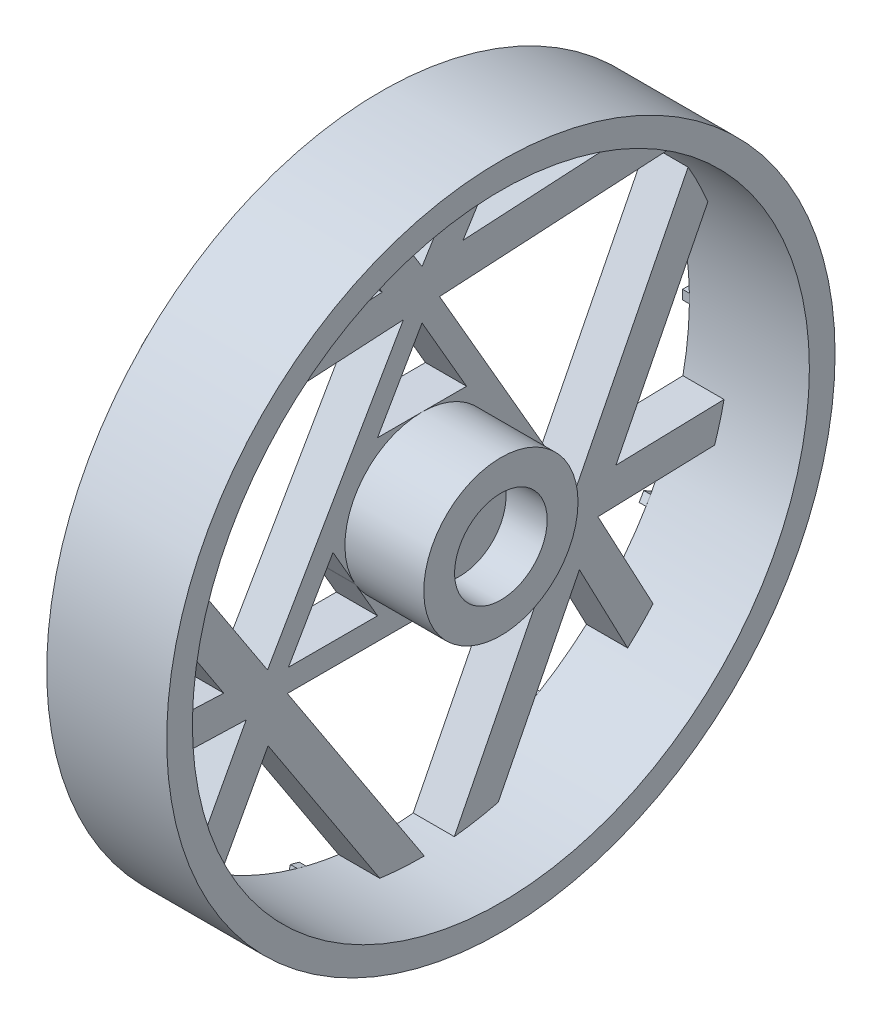
from build123d import *

# Parameters (mm, degrees)
SKETCH4_R             = 97.5
SKETCH4_R_2           = 90
BOSS_EXTRUDE1_DEPTH   = 35
SKETCH4_R_3           = 22.5
BOSS_EXTRUDE1_2_DEPTH = 35
BOSS_EXTRUDE2_DEPTH   = 12
BOSS_EXTRUDE3_DEPTH   = 12
BOSS_EXTRUDE8_DEPTH   = 12
CIRPATTERN1_COUNT     = 3
SKETCH21_R            = 13.5
CUT_EXTRUDE3_DEPTH    = 12
BOSS_EXTRUDE9_DEPTH   = 12
SKETCH24_R            = 13.983659749
SKETCH24_R_2          = 11.823757764
SKETCH24_R_3          = 1.244512658
CUT_EXTRUDE4_DEPTH    = 4
SKETCH25_W            = 2.692876203
SKETCH25_H            = 4.720029148
SKETCH25_W_2          = 4.720029148
SKETCH25_H_2          = 2.692876204
SKETCH25_W_3          = 2.692876204
SKETCH25_H_3          = 2.692876203
BOSS_EXTRUDE10_DEPTH  = 2


with BuildPart() as part:
    # Sketch4 → Boss-Extrude1 (new body)
    with BuildSketch(Plane(origin=(0, 0, 0), x_dir=(0, 0, -1), z_dir=(1, 0, 0))):
        Circle(SKETCH4_R)
        Circle(SKETCH4_R_2, mode=Mode.SUBTRACT)
    extrude(amount=BOSS_EXTRUDE1_DEPTH)



with BuildPart() as body_2:
    # Sketch4 → Boss-Extrude1 2 (new body)
    with BuildSketch(Plane(origin=(0, 0, 0), x_dir=(0, 0, -1), z_dir=(1, 0, 0))):
        Circle(SKETCH4_R_3)
    extrude(amount=BOSS_EXTRUDE1_2_DEPTH)

    # Sketch21 → Cut-Extrude3 (cut)
    with BuildSketch(Plane(origin=(35, 0, 0), x_dir=(0, 0, -1), z_dir=(1, 0, 0))):
        Circle(SKETCH21_R)
    extrude(amount=-CUT_EXTRUDE3_DEPTH, mode=Mode.SUBTRACT)


with BuildPart() as body_3:
    # Sketch1 → Boss-Extrude2 (new body)
    with BuildSketch(Plane(origin=(0, 0, 0), x_dir=(0, 0, -1), z_dir=(1, 0, 0))):
        Polygon((50.193376868, -28.979159646), (0, 57.958319293), (-50.193376868, -28.979159646), align=None)
        Polygon((38.97114317, -22.5), (0, 45), (-38.97114317, -22.5), align=None, mode=Mode.SUBTRACT)
    extrude(amount=BOSS_EXTRUDE2_DEPTH)


with BuildPart() as part_1:
    add(part.part)

    add(body_3.part)  # Boss-Extrude3 merges body 3
    # Sketch8 → Boss-Extrude3 (add)
    with BuildSketch(Plane(origin=(0, 0, 0), x_dir=(0, 0, -1), z_dir=(1, 0, 0))):
        with BuildLine():
            Line((5.455789025, -97.347236048), (-87.033073918, 43.94876613))
            ThreePointArc((-87.033073918, 43.94876613), (-89.670128884, 38.282084399), (-91.938690055, 32.458084833))
            Line((-91.938690055, 32.458084833), (-7.037829715, -97.2456629))
            ThreePointArc((-7.037829715, -97.2456629), (-0.792649016, -97.496777934), (5.455789025, -97.347236048))
        make_face()
        with BuildLine():
            ThreePointArc((87.736129337, 42.527892129), (84.831010986, 48.061934783), (81.577284893, 53.398469917))
            Line((81.577284893, 53.398469917), (5.455789025, -97.347236048))
            ThreePointArc((5.455789025, -97.347236048), (11.681806842, -96.797651774), (17.859819003, -95.850283595))
            Line((17.859819003, -95.850283595), (87.736129337, 42.527892129))
        make_face()
        with BuildLine():
            Line((-87.033073918, 43.94876613), (81.577284893, 53.398469917))
            ThreePointArc((81.577284893, 53.398469917), (77.988322042, 58.515567374), (74.078871051, 63.392198761))
            Line((74.078871051, 63.392198761), (-80.698299622, 54.717770771))
            ThreePointArc((-80.698299622, 54.717770771), (-84.03836197, 49.434843151), (-87.033073918, 43.94876613))
        make_face()
    extrude(amount=BOSS_EXTRUDE3_DEPTH)

    # Sketch10 → Boss-Extrude8 (add)
    with BuildSketch(Plane(origin=(0, 0, 0), x_dir=(0, 0, -1), z_dir=(1, 0, 0))):
        with BuildLine():
            ThreePointArc((17.95863159, 88.190064925), (23.214218937, 87.469047382), (28.135682808, 85.489083238))
            Line((28.135682808, 85.489083238), (5.107007883, 49.112722165))
            Line((5.107007883, 49.112722165), (0, 59.240476451))
            Line((0, 59.240476451), (17.95863159, 88.190064925))
        make_face()
        with BuildLine():
            Line((0, 59.240476451), (-17.95863159, 88.190064925))
            ThreePointArc((-17.95863159, 88.190064925), (-23.214218937, 87.469047382), (-28.135682808, 85.489083238))
            Line((-28.135682808, 85.489083238), (-5.448558323, 48.52113945))
            Line((-5.448558323, 48.52113945), (0, 59.240476451))
        make_face()
    boss_extrude8 = extrude(amount=BOSS_EXTRUDE8_DEPTH)

    # CirPattern1: Boss-Extrude8 ×3 about axis
    cirpattern1_axis = Axis((0, 0, 0), (1, 0, 0))
    for i in range(1, CIRPATTERN1_COUNT):
        add(boss_extrude8.rotate(cirpattern1_axis, i * 360 / CIRPATTERN1_COUNT))


    add(body_2.part)  # Boss-Extrude9 merges body 2
    # Sketch23 → Boss-Extrude9 (add)
    with BuildSketch(Plane.ZY):
        Polygon((-12.989618466, 22.501320846), (12.989618466, 22.501320846), (25.980762114, 0), (12.989618466, -22.5), (-12.989618466, -22.5), (-25.980380818, 0.000660423), align=None)
    extrude(amount=-BOSS_EXTRUDE9_DEPTH)

    # Sketch24 → Cut-Extrude4 (cut)
    # profile 1 of 9: a face of its own
    with BuildSketch(Plane.ZY):
        Circle(SKETCH24_R)
        Circle(SKETCH24_R_2, mode=Mode.SUBTRACT)
    # profile 2 of 9: a face of its own
    with BuildSketch(Plane.ZY):
        with Locations((10.459157741, 16.348050554)):
            Circle(SKETCH24_R_3)
    # profile 3 of 9: a face of its own
    with BuildSketch(Plane.ZY):
        with Locations((-4.164076042, 18.95555877)):
            Circle(SKETCH24_R_3)
    # profile 4 of 9: a face of its own
    with BuildSketch(Plane.ZY):
        with Locations((-16.348050554, 10.459157741)):
            Circle(SKETCH24_R_3)
    # profile 5 of 9: a face of its own
    with BuildSketch(Plane.ZY):
        with Locations((-18.95555877, -4.164076042)):
            Circle(SKETCH24_R_3)
    # profile 6 of 9: a face of its own
    with BuildSketch(Plane.ZY):
        with Locations((-10.459157741, -16.348050554)):
            Circle(SKETCH24_R_3)
    # profile 7 of 9: a face of its own
    with BuildSketch(Plane.ZY):
        with Locations((4.164076042, -18.95555877)):
            Circle(SKETCH24_R_3)
    # profile 8 of 9: a face of its own
    with BuildSketch(Plane.ZY):
        with Locations((16.348050554, -10.459157741)):
            Circle(SKETCH24_R_3)
    # profile 9 of 9: a face of its own
    with BuildSketch(Plane.ZY):
        with Locations((18.95555877, 4.164076042)):
            Circle(SKETCH24_R_3)
    extrude(amount=-CUT_EXTRUDE4_DEPTH, mode=Mode.SUBTRACT)

    # Sketch25 → Boss-Extrude10 (add)
    with BuildSketch(Plane.ZY):
        Polygon((24.750875914, 86.529729813), (25.972509351, 91.088927869), (23.371390679, 91.785895516), (22.149757242, 87.226697461), align=None)
        with Locations((0.165530124, 92.347313412)):
            Rectangle(SKETCH25_W, SKETCH25_H)
        Polygon((46.303052312, 77.175302699), (48.663066886, 81.262967848), (46.330967684, 82.60940595), (43.97095311, 78.521740801), align=None)
        Polygon((64.699752214, 62.561506244), (68.037316832, 65.899070862), (66.133165808, 67.803221887), (62.795601189, 64.465657268), align=None)
        Polygon((78.687270924, 43.684246526), (82.774936073, 46.0442611), (81.428497972, 48.376360302), (77.340832822, 46.016345728), align=None)
        Polygon((87.312382158, 21.829977599), (91.871580213, 23.051611036), (91.174612566, 25.652729709), (86.61541451, 24.431096271), align=None)
        with Locations((92.347313412, -0.165530123)):
            Rectangle(SKETCH25_W_2, SKETCH25_H_2)
        Polygon((86.529729813, -24.750875914), (91.088927869, -25.972509351), (91.785895516, -23.371390679), (87.226697461, -22.149757242), align=None)
        Polygon((77.175302699, -46.303052312), (81.262967848, -48.663066886), (82.60940595, -46.330967684), (78.521740801, -43.97095311), align=None)
        Polygon((62.561506244, -64.699752214), (65.899070862, -68.037316832), (67.803221887, -66.133165808), (64.465657268, -62.795601189), align=None)
        Polygon((43.684246526, -78.687270924), (46.0442611, -82.774936073), (48.376360302, -81.428497972), (46.016345728, -77.340832822), align=None)
        Polygon((21.829977599, -87.312382157), (23.051611036, -91.871580213), (25.652729709, -91.174612566), (24.431096271, -86.61541451), align=None)
        with Locations((-0.165530123, -92.347313412)):
            Rectangle(SKETCH25_W_3, SKETCH25_H)
        Polygon((-24.750875914, -86.529729813), (-25.972509351, -91.088927869), (-23.371390679, -91.785895516), (-22.149757242, -87.226697461), align=None)
        Polygon((-46.303052311, -77.175302699), (-48.663066886, -81.262967848), (-46.330967684, -82.60940595), (-43.97095311, -78.521740801), align=None)
        Polygon((-64.699752214, -62.561506244), (-68.037316832, -65.899070862), (-66.133165808, -67.803221887), (-62.795601189, -64.465657268), align=None)
        Polygon((-78.687270924, -43.684246526), (-82.774936073, -46.0442611), (-81.428497971, -48.376360302), (-77.340832822, -46.016345728), align=None)
        Polygon((-87.312382157, -21.829977599), (-91.871580213, -23.051611036), (-91.174612566, -25.652729709), (-86.61541451, -24.431096271), align=None)
        with Locations((-92.347313412, 0.165530124)):
            Rectangle(SKETCH25_W_2, SKETCH25_H_3)
        Polygon((-86.529729813, 24.750875914), (-91.088927869, 25.972509351), (-91.785895516, 23.371390679), (-87.226697461, 22.149757242), align=None)
        Polygon((-77.175302699, 46.303052312), (-81.262967848, 48.663066886), (-82.60940595, 46.330967684), (-78.521740801, 43.97095311), align=None)
        Polygon((-62.561506244, 64.699752214), (-65.899070862, 68.037316832), (-67.803221887, 66.133165808), (-64.465657268, 62.795601189), align=None)
        Polygon((-43.684246526, 78.687270924), (-46.0442611, 82.774936073), (-48.376360302, 81.428497972), (-46.016345728, 77.340832822), align=None)
        Polygon((-21.829977599, 87.312382157), (-23.051611036, 91.871580213), (-25.652729709, 91.174612566), (-24.431096271, 86.61541451), align=None)
    extrude(amount=BOSS_EXTRUDE10_DEPTH)


solid = part_1.part
